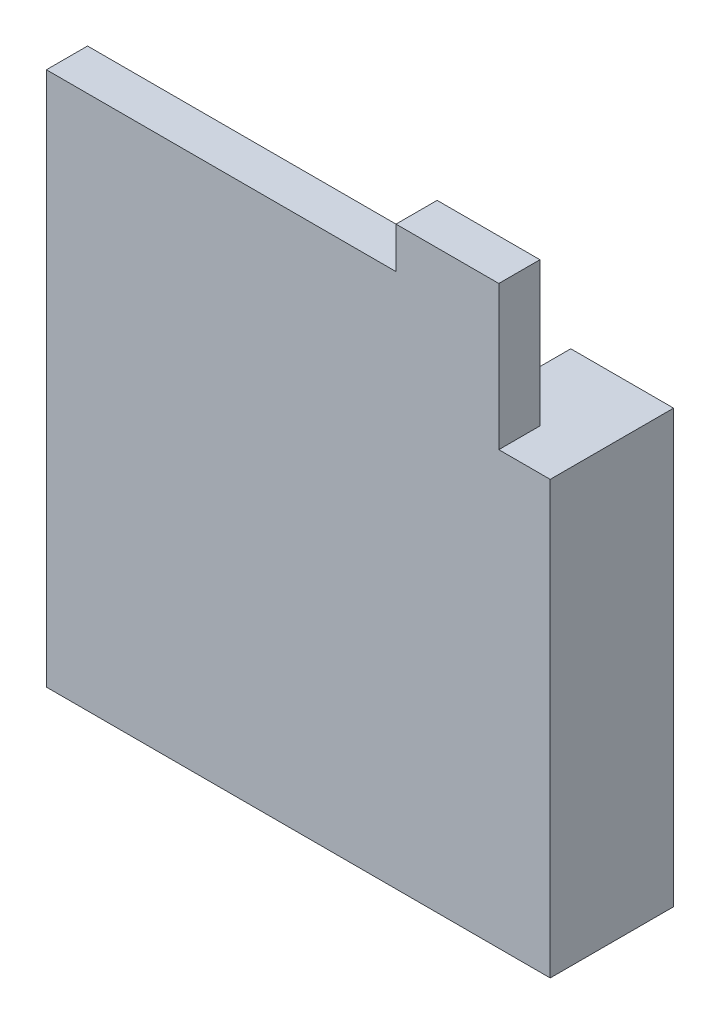
from build123d import *

# Parameters (mm, degrees)
BOSS_EXTRUDE1_DEPTH = 1
CUT_EXTRUDE1_DEPTH  = 11.325938214
SKETCH3_W           = 2.5
SKETCH3_H           = 10.5
BOSS_EXTRUDE2_DEPTH = 3


with BuildPart() as part:
    # Sketch1 → Boss-Extrude1 (new body)
    with BuildSketch(Plane.XY):
        Polygon((2.75, 6.75), (-5.75, 6.75), (-5.75, -6.75), (6.75, -6.75), (6.75, 4.25), (5.75, 4.25), (5.75, 7.75), (2.75, 7.75), align=None)
    extrude(amount=-BOSS_EXTRUDE1_DEPTH)

    # Sketch2 → Cut-Extrude1 (cut, through all)
    with BuildSketch(Plane.XY):
        Polygon((6.75, 4.25), (5.75, 4.25), (5.75, 7.75), (2.75, 7.75), (2.75, 6.75), (-5.75, 6.75), (-5.75, -6.75), (6.75, -6.75), (6.75, -6.5), (6.5, -6.5), (-5.5, -6.5), (-5.5, 6.5), (3, 6.5), (3, 7.5), (5.5, 7.5), (5.5, 4), (6.5, 4), (6.75, 4), align=None)
    extrude(amount=-CUT_EXTRUDE1_DEPTH, mode=Mode.SUBTRACT)

    # Sketch3 → Boss-Extrude2 (add)
    with BuildSketch(Plane(origin=(0, 0, 0), x_dir=(-1, 0, 0), z_dir=(0, 0, -1))):
        with Locations((-5.5, -1.25)):
            Rectangle(SKETCH3_W, SKETCH3_H)
    extrude(amount=BOSS_EXTRUDE2_DEPTH)


solid = part.part
